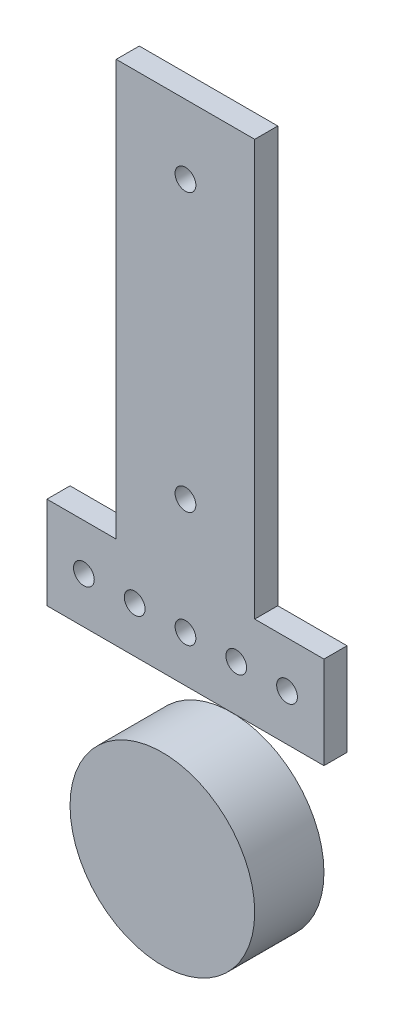
from build123d import *

# Parameters (mm, degrees)
SKETCH1_R           = 2.25
BOSS_EXTRUDE1_DEPTH = 2.5
SKETCH1_3_R         = 20
BOSS_EXTRUDE2_DEPTH = 7.5


with BuildPart() as part:
    # Sketch1 → Boss-Extrude1 (new, symmetric)
    with BuildSketch(Plane.XY):
        Polygon((30, -15), (15, -15), (15, 75), (-15, 75), (-15, -15), (-30, -15), (-30, -35), (30, -35), align=None)
        with Locations((-22, -25)):
            Circle(SKETCH1_R, mode=Mode.SUBTRACT)
        with Locations((-11, -25)):
            Circle(SKETCH1_R, mode=Mode.SUBTRACT)
        with Locations((0, -25)):
            Circle(SKETCH1_R, mode=Mode.SUBTRACT)
        with Locations((11, -25)):
            Circle(SKETCH1_R, mode=Mode.SUBTRACT)
        with Locations((22, -25)):
            Circle(SKETCH1_R, mode=Mode.SUBTRACT)
        with Locations((0, 60)):
            Circle(SKETCH1_R, mode=Mode.SUBTRACT)
        Circle(SKETCH1_R, mode=Mode.SUBTRACT)
    extrude(amount=BOSS_EXTRUDE1_DEPTH, both=True)


with BuildPart() as body_2:
    # Sketch1<3> → Boss-Extrude2 (new, symmetric)
    with BuildSketch(Plane.XY):
        with Locations((0, -65)):
            Circle(SKETCH1_3_R)
    extrude(amount=BOSS_EXTRUDE2_DEPTH, both=True)


solid = Compound([part.part, body_2.part])
